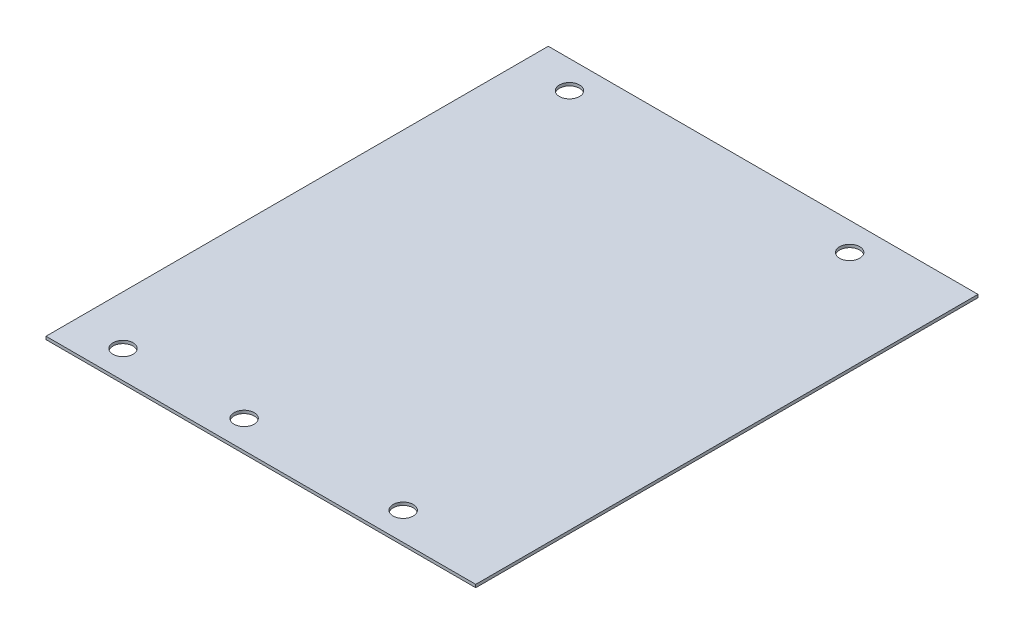
from build123d import *

# Parameters (mm, degrees)
CROQUIS1_W              = 385
CROQUIS1_H              = 450
SALIENTE_EXTRUIR1_DEPTH = 2.66
CROQUIS2_R              = 9
CORTAR_EXTRUIR1_DEPTH   = 3


with BuildPart() as part:
    # Croquis1 → Saliente-Extruir1 (new body)
    with BuildSketch(Plane(origin=(0, 0, 0), x_dir=(1, 0, 0), z_dir=(0, 1, 0))):
        Rectangle(CROQUIS1_W, CROQUIS1_H)
    extrude(amount=SALIENTE_EXTRUIR1_DEPTH)

    # Croquis2 → Cortar-Extruir1 (cut)
    with BuildSketch(Plane(origin=(0, 2.66, 0), x_dir=(1, 0, 0), z_dir=(0, 1, 0))):
        with Locations(Location((-148.5, 200, 0), (0, 0, 270))):
            Circle(CROQUIS2_R)
        with Locations(Location((102.5, 200, 0), (0, 0, 270))):
            Circle(CROQUIS2_R)
        with Locations(Location((-148.5, -200, 0), (0, 0, 270))):
            Circle(CROQUIS2_R)
        with Locations(Location((-40, -200, 0), (0, 0, 270))):
            Circle(CROQUIS2_R)
        with Locations(Location((102.5, -200, 0), (0, 0, 270))):
            Circle(CROQUIS2_R)
    extrude(amount=-CORTAR_EXTRUIR1_DEPTH, mode=Mode.SUBTRACT)


solid = part.part
